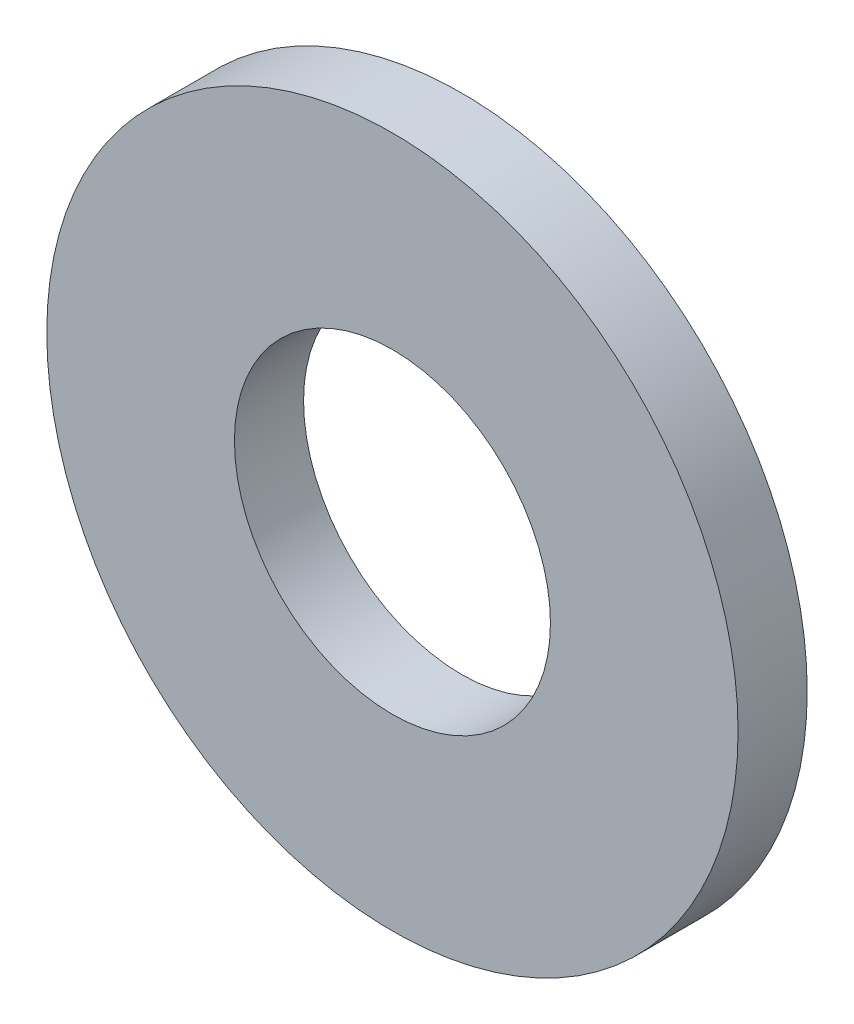
from build123d import *

# Parameters (mm, degrees)
SKETCH_2_R        = 3.5
SKETCH_2_R_2      = 1.6
EXTRUDE_335_DEPTH = 0.7


with BuildPart() as part:
    # Эскиз2 → Extrude 335 (new body)
    with BuildSketch(Plane.XY):
        Circle(SKETCH_2_R)
        Circle(SKETCH_2_R_2, mode=Mode.SUBTRACT)
    extrude(amount=EXTRUDE_335_DEPTH)


solid = part.part
